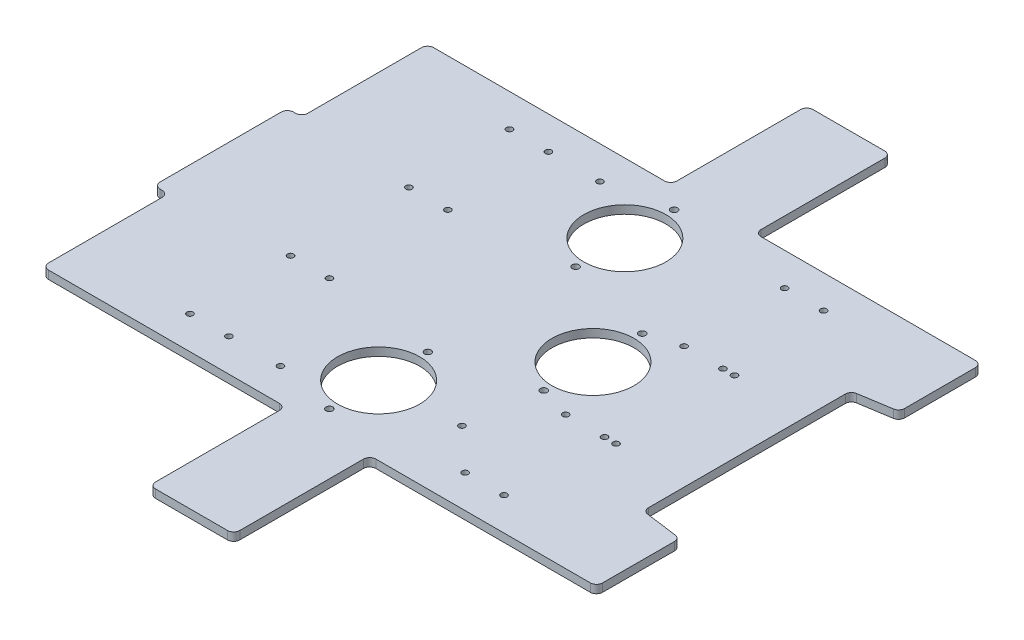
from build123d import *

# Parameters (mm, degrees)
SKETCH1_R           = 20
SKETCH1_R_2         = 1.5
SKETCH1_R_3         = 1.65
BOSS_EXTRUDE2_DEPTH = 4
FILLET1_R           = 3


with BuildPart() as part:
    # Sketch1 → Boss-Extrude2 (new body)
    with BuildSketch(Plane(origin=(0, 0, 0), x_dir=(1, 0, 0), z_dir=(0, 1, 0))):
        Polygon((92.45867298, 93.85), (92.45867298, 53.803836873), (71.914755495, 50.55), (71.914755495, -50.55), (92.528223413, -53.3293777), (92.45867298, -93.85), (-18.04132702, -93.85), (-18.04132702, -160.15), (-59.04132702, -160.15), (-59.04132702, -93.85), (-177.54132702, -93.85), (-177.54132702, -32.5), (-184.54132702, -32.5), (-184.54132702, 32.5), (-177.54132702, 32.5), (-177.54132702, 34.274594508), (-177.54132702, 93.85), (-59.04132702, 93.85), (-59.04132702, 160.15), (-18.04132702, 160.15), (-18.04132702, 93.85), align=None)
        with Locations(Location((-47.54132702, 60, 0), (0, 0, 270))):
            Circle(SKETCH1_R, mode=Mode.SUBTRACT)
        with Locations(Location((-3.085244505, 0, 0), (0, 0, 270))):
            Circle(SKETCH1_R, mode=Mode.SUBTRACT)
        with Locations(Location((-47.54132702, -60, 0), (0, 0, 90))):
            Circle(SKETCH1_R, mode=Mode.SUBTRACT)
        with Locations(Location((-77.54132702, 77.85, 0), (0, 0, 270))):
            Circle(SKETCH1_R_2, mode=Mode.SUBTRACT)
        with Locations(Location((-121.62132702, 28.85, 0), (0, 0, 270))):
            Circle(SKETCH1_R_2, mode=Mode.SUBTRACT)
        with Locations(Location((-102.65132702, 28.85, 0), (0, 0, 270))):
            Circle(SKETCH1_R_2, mode=Mode.SUBTRACT)
        with Locations(Location((-121.62132702, -28.85, 0), (0, 0, 90))):
            Circle(SKETCH1_R_2, mode=Mode.SUBTRACT)
        with Locations(Location((-102.65132702, -28.85, 0), (0, 0, 90))):
            Circle(SKETCH1_R_2, mode=Mode.SUBTRACT)
        with Locations(Location((-77.54132702, -77.85, 0), (0, 0, 90))):
            Circle(SKETCH1_R_2, mode=Mode.SUBTRACT)
        with Locations(Location((37.024755495, 28.85, 0), (0, 0, 270))):
            Circle(SKETCH1_R_2, mode=Mode.SUBTRACT)
        with Locations(Location((12.45867298, 77.85, 0), (0, 0, 270))):
            Circle(SKETCH1_R_2, mode=Mode.SUBTRACT)
        with Locations(Location((-8.085244505, -58.85, 0), (0, 0, 270))):
            Circle(SKETCH1_R_2, mode=Mode.SUBTRACT)
        with Locations(Location((12.45867298, -77.85, 0), (0, 0, 90))):
            Circle(SKETCH1_R_2, mode=Mode.SUBTRACT)
        with Locations(Location((37.024755495, -28.85, 0), (0, 0, 90))):
            Circle(SKETCH1_R_2, mode=Mode.SUBTRACT)
        with Locations(Location((-121.62132702, -77.85, 0), (0, 0, 90))):
            Circle(SKETCH1_R_2, mode=Mode.SUBTRACT)
        with Locations(Location((-102.65132702, -77.85, 0), (0, 0, 90))):
            Circle(SKETCH1_R_2, mode=Mode.SUBTRACT)
        with Locations(Location((31.42867298, -77.85, 0), (0, 0, 90))):
            Circle(SKETCH1_R_2, mode=Mode.SUBTRACT)
        with Locations(Location((12.444755495, -28.85, 0), (0, 0, 90))):
            Circle(SKETCH1_R_2, mode=Mode.SUBTRACT)
        with Locations(Location((31.414755495, -28.85, 0), (0, 0, 90))):
            Circle(SKETCH1_R_2, mode=Mode.SUBTRACT)
        with Locations(Location((-121.62132702, 77.85, 0), (0, 0, 270))):
            Circle(SKETCH1_R_2, mode=Mode.SUBTRACT)
        with Locations(Location((-102.65132702, 77.85, 0), (0, 0, 270))):
            Circle(SKETCH1_R_2, mode=Mode.SUBTRACT)
        with Locations(Location((31.414755495, 28.85, 0), (0, 0, 270))):
            Circle(SKETCH1_R_2, mode=Mode.SUBTRACT)
        with Locations(Location((12.444755495, 28.85, 0), (0, 0, 270))):
            Circle(SKETCH1_R_2, mode=Mode.SUBTRACT)
        with Locations(Location((31.42867298, 77.85, 0), (0, 0, 270))):
            Circle(SKETCH1_R_2, mode=Mode.SUBTRACT)
        with Locations(Location((-47.54132702, -84, 0), (0, 0, 270))):
            Circle(SKETCH1_R_3, mode=Mode.SUBTRACT)
        with Locations(Location((-47.54132702, -36, 0), (0, 0, 270))):
            Circle(SKETCH1_R_3, mode=Mode.SUBTRACT)
        with Locations(Location((-3.085244505, -24, 0), (0, 0, 270))):
            Circle(SKETCH1_R_3, mode=Mode.SUBTRACT)
        with Locations(Location((-3.085244505, 24, 0), (0, 0, 270))):
            Circle(SKETCH1_R_3, mode=Mode.SUBTRACT)
        with Locations(Location((-47.54132702, 36, 0), (0, 0, 270))):
            Circle(SKETCH1_R_3, mode=Mode.SUBTRACT)
        with Locations(Location((-47.54132702, 84, 0), (0, 0, 270))):
            Circle(SKETCH1_R_3, mode=Mode.SUBTRACT)
    extrude(amount=BOSS_EXTRUDE2_DEPTH)

    # Fillet1
    fillet1_edges = [part.edges().sort_by_distance(p)[0] for p in [
        (-177.54132702, 2, -93.85),
        (-59.04132702, 2, -93.85),
        (-59.04132702, 2, -160.15),
        (-18.04132702, 2, -160.15),
        (-18.04132702, 2, -93.85),
        (92.45867298, 2, -93.85),
        (92.45867298, 2, -53.803836873),
        (71.914755495, 2, -50.55),
        (71.914755495, 2, 50.55),
        (92.528223413, 2, 53.3293777),
        (92.45867298, 2, 93.85),
        (-18.04132702, 2, 93.85),
        (-18.04132702, 2, 160.15),
        (-59.04132702, 2, 160.15),
        (-59.04132702, 2, 93.85),
        (-177.54132702, 2, 93.85),
        (-177.54132702, 2, 32.5),
        (-184.54132702, 2, 32.5),
        (-184.54132702, 2, -32.5),
        (-177.54132702, 2, -32.5),
    ]]
    fillet(fillet1_edges, radius=FILLET1_R)


solid = part.part
